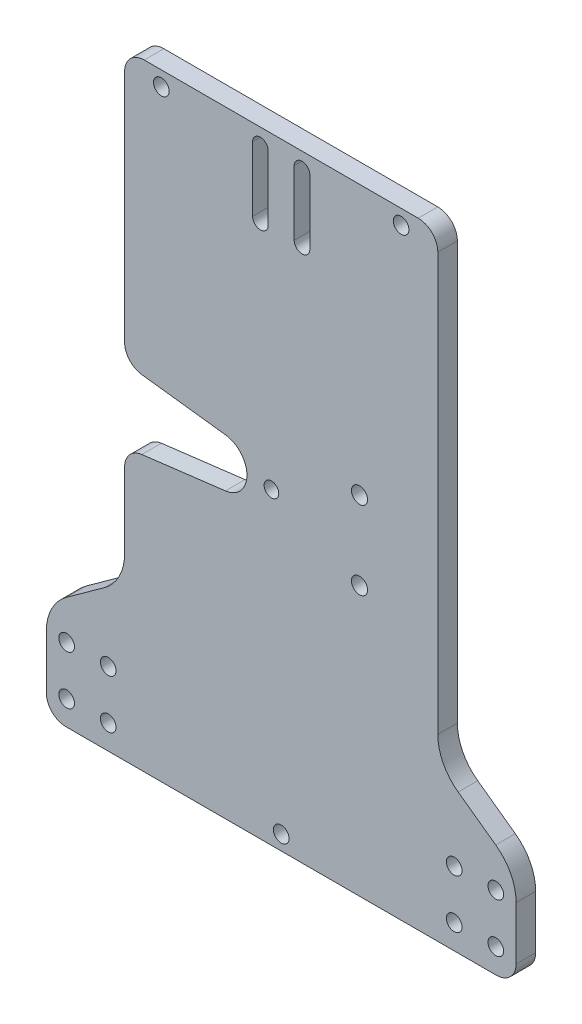
from build123d import *

# Parameters (mm, degrees)
SKETCH1_R           = 1.6
SKETCH1_R_2         = 1.65
SKETCH1_R_3         = 1.5
BOSS_EXTRUDE1_DEPTH = 4
FILLET1_R           = 4
FILLET2_R           = 10


with BuildPart() as part:
    # Sketch1 → Boss-Extrude1 (new body)
    with BuildSketch(Plane.XY):
        with BuildLine():
            Line((0, 0), (96, 0))
            Line((96, 0), (96, 20))
            Line((96, 20), (80, 31.52))
            Line((80, 31.52), (80, 126))
            Line((80, 126), (16, 126))
            Line((16, 126), (16, 70.5))
            Line((16, 70.5), (36.610950109, 67.962533624))
            ThreePointArc((36.610950109, 67.962533624), (41, 63), (36.610950109, 58.037466376))
            Line((36.610950109, 58.037466376), (16, 55.5))
            Line((16, 55.5), (16, 31.52))
            Line((16, 31.52), (0, 20))
            Line((0, 20), (0, 0))
        make_face()
        with Locations((4.15, 5)):
            Circle(SKETCH1_R, mode=Mode.SUBTRACT)
        with Locations((12.65, 5)):
            Circle(SKETCH1_R, mode=Mode.SUBTRACT)
        with Locations((12.65, 15)):
            Circle(SKETCH1_R, mode=Mode.SUBTRACT)
        with Locations((4.15, 15)):
            Circle(SKETCH1_R, mode=Mode.SUBTRACT)
        with Locations(Location((91.85, 5, 0), (0, 0, 180))):
            Circle(SKETCH1_R, mode=Mode.SUBTRACT)
        with Locations(Location((83.35, 5, 0), (0, 0, 180))):
            Circle(SKETCH1_R, mode=Mode.SUBTRACT)
        with Locations(Location((83.35, 15, 0), (0, 0, 180))):
            Circle(SKETCH1_R, mode=Mode.SUBTRACT)
        with Locations(Location((91.85, 15, 0), (0, 0, 180))):
            Circle(SKETCH1_R, mode=Mode.SUBTRACT)
        with Locations((48, 3)):
            Circle(SKETCH1_R, mode=Mode.SUBTRACT)
        with Locations((23.5, 123)):
            Circle(SKETCH1_R, mode=Mode.SUBTRACT)
        with Locations((72.5, 123)):
            Circle(SKETCH1_R, mode=Mode.SUBTRACT)
        with Locations((64, 71)):
            Circle(SKETCH1_R_2, mode=Mode.SUBTRACT)
        with Locations((64, 55)):
            Circle(SKETCH1_R_2, mode=Mode.SUBTRACT)
        with Locations((46, 63)):
            Circle(SKETCH1_R_3, mode=Mode.SUBTRACT)
        with BuildLine():
            Line((45.35, 122.6), (45.35, 109.4))
            ThreePointArc((45.35, 109.4), (43.75, 107.8), (42.15, 109.4))
            Line((42.15, 109.4), (42.15, 122.6))
            ThreePointArc((42.15, 122.6), (43.75, 124.2), (45.35, 122.6))
        make_face(mode=Mode.SUBTRACT)
        with BuildLine():
            Line((50.65, 109.4), (50.65, 122.6))
            ThreePointArc((50.65, 122.6), (52.25, 124.2), (53.85, 122.6))
            Line((53.85, 122.6), (53.85, 109.4))
            ThreePointArc((53.85, 109.4), (52.25, 107.8), (50.65, 109.4))
        make_face(mode=Mode.SUBTRACT)
    extrude(amount=BOSS_EXTRUDE1_DEPTH)

    # Fillet1
    fillet1_edges = [part.edges().sort_by_distance(p)[0] for p in [
        (16, 55.5, 2),
        (16, 70.5, 2),
        (16, 126, 2),
        (80, 126, 2),
        (96, 0, 2),
        (0, 0, 2),
    ]]
    fillet(fillet1_edges, radius=FILLET1_R)

    # Fillet2
    fillet2_edges = [part.edges().sort_by_distance(p)[0] for p in [
        (0, 20, 2),
        (16, 31.52, 2),
        (80, 31.52, 2),
        (96, 20, 2),
    ]]
    fillet(fillet2_edges, radius=FILLET2_R)


solid = part.part
